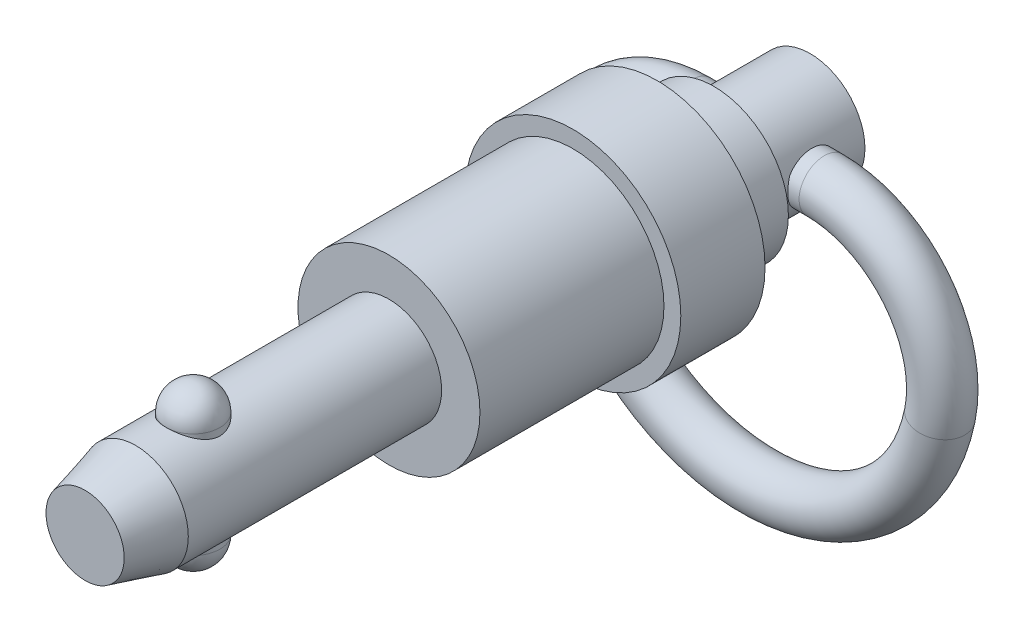
from build123d import *

# Parameters (mm, degrees)
CHAMFER1_SIZE  = 3
CHAMFER1_SIZE2 = 0.803847577
SKETCH4_R      = 1.5


with BuildPart() as part:
    # Sketch1 → Revolve1 (revolve)
    with BuildSketch(Plane(origin=(0, 0, 0), x_dir=(0, 0, -1), z_dir=(1, 0, 0)), mode=Mode.PRIVATE) as revolve1_sk:
        Polygon((0, 0), (0, 3.125), (18.034, 3.125), (18.034, 5.4), (28.956, 5.4), (28.956, 6.4), (33.956, 6.4), (33.956, 4.416438242), (37.324805723, 4.416438242), (37.324805723, 3.25), (43.034, 3.25), (43.034, 0), align=None)
    revolve(revolve1_sk.sketch.rotate(Axis((0, 0, 6.254285714), (0, 0, -1)), 90), axis=Axis((0, 0, 6.254285714), (0, 0, -1)))

    # Chamfer1
    chamfer1_edges = [part.edges().sort_by_distance(p)[0] for p in [
        (-3.125, 0, 0),
    ]]
    chamfer1_side = [part.faces().sort_by_distance(p)[0] for p in [
        (-3.125, 0, -9.017),
    ]]
    chamfer(chamfer1_edges, length=CHAMFER1_SIZE, length2=CHAMFER1_SIZE2, reference=chamfer1_side[0])

    # Sketch2 → Revolve2 (revolve)
    with BuildSketch(Plane(origin=(0, 0, 0), x_dir=(0, 0, -1), z_dir=(1, 0, 0))):
        with BuildLine():
            Line((8, 3.125), (8, -3.125))
            ThreePointArc((8, -3.125), (7.535764248, -4.245764248), (6.415, -4.71))
            Line((6.415, -4.71), (6.415, 4.71))
            ThreePointArc((6.415, 4.71), (7.535764248, 4.245764248), (8, 3.125))
        make_face()
    revolve(axis=Axis((0, 4.71, -6.415), (0, -1, 0)))

    # Sweep2: sweep along a path in Sketch3
    with BuildLine(Plane(origin=(0, 42, -39.956), x_dir=(1, 0, 0), z_dir=(0, 0, -1))) as sweep2_path:
        Line((0, 42), (-3.919183588, 42))
        ThreePointArc((-3.919183588, 42), (-9.341360273, 44.572811276), (-10.777754868, 50.4))
        ThreePointArc((-10.777754868, 50.4), (0, 59.2), (10.777754868, 50.4))
        ThreePointArc((10.777754868, 50.4), (9.341360273, 44.572811276), (3.919183588, 42))
        Line((3.919183588, 42), (3.166927962, 42))
    # Sketch4 → Sweep2 (sweep)
    with BuildSketch(Plane(origin=(0, 0, 0), x_dir=(0, 0, -1), z_dir=(1, 0, 0))):
        with Locations((39.956, 0)):
            Circle(SKETCH4_R)
    sweep(path=sweep2_path.line)


solid = part.part
